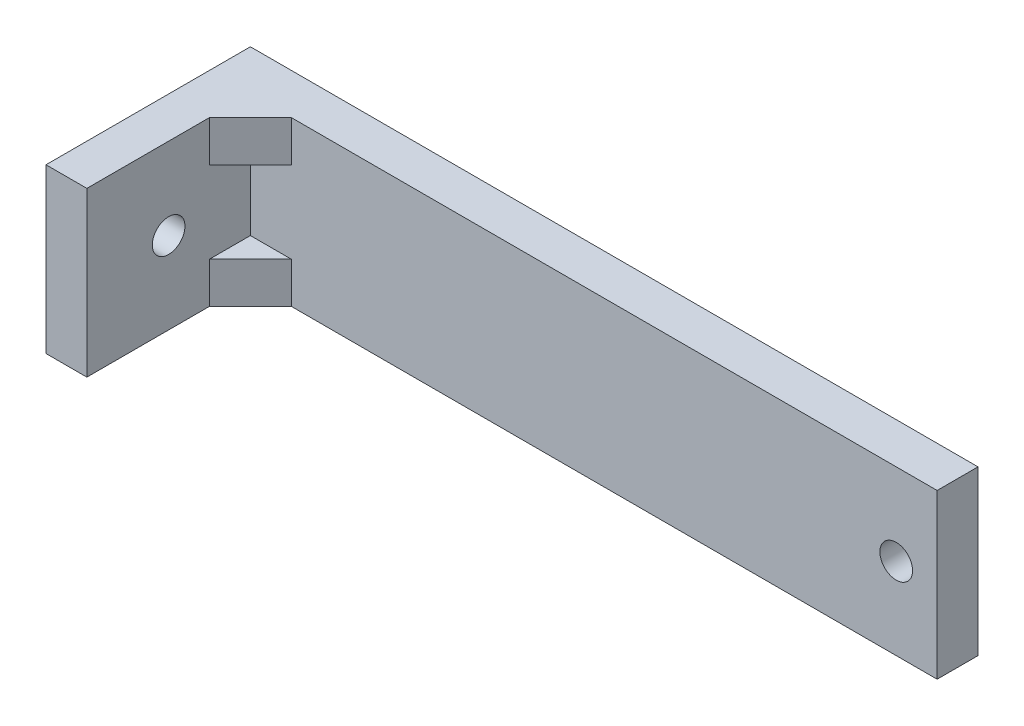
from build123d import *

# Parameters (mm, degrees)
SKETCH1_W           = 89
SKETCH1_H           = 20
BOSS_EXTRUDE1_DEPTH = 5
SKETCH2_W           = 5
SKETCH2_H           = 20
BOSS_EXTRUDE2_DEPTH = 20
SKETCH3_R           = 2
CUT_EXTRUDE1_DEPTH  = 89.20997676
SKETCH4_R           = 2
CUT_EXTRUDE2_DEPTH  = 20
SKETCH5_W           = 5
SKETCH5_H           = 5
BOSS_EXTRUDE3_DEPTH = 5
CUT_EXTRUDE3_DEPTH  = 55.820160525


with BuildPart() as part:
    # Sketch1 → Boss-Extrude1 (new body)
    with BuildSketch(Plane.XY):
        Rectangle(SKETCH1_W, SKETCH1_H)
    extrude(amount=BOSS_EXTRUDE1_DEPTH)

    # Sketch2 → Boss-Extrude2 (add)
    with BuildSketch(Plane.XY.offset(5)):
        with Locations((-42, 0)):
            Rectangle(SKETCH2_W, SKETCH2_H)
    extrude(amount=BOSS_EXTRUDE2_DEPTH)

    # Sketch3 → Cut-Extrude1 (cut, through all)
    with BuildSketch(Plane(origin=(-39.5, 0, 0), x_dir=(0, 0, -1), z_dir=(1, 0, 0))):
        with Locations((-15, 0)):
            Circle(SKETCH3_R)
    extrude(amount=-CUT_EXTRUDE1_DEPTH, mode=Mode.SUBTRACT)

    # Sketch4 → Cut-Extrude2 (cut)
    with BuildSketch(Plane(origin=(0, 0, 0), x_dir=(-1, 0, 0), z_dir=(0, 0, -1))):
        with Locations((-39.5, 0)):
            Circle(SKETCH4_R)
    extrude(amount=-CUT_EXTRUDE2_DEPTH, mode=Mode.SUBTRACT)

    # Sketch5 → Boss-Extrude3 (add)
    with BuildSketch(Plane(origin=(-39.5, 0, 0), x_dir=(0, 0, -1), z_dir=(1, 0, 0))):
        with Locations((-7.5, -7.5)):
            Rectangle(SKETCH5_W, SKETCH5_H)
        with Locations((-7.5, 7.5)):
            Rectangle(SKETCH5_W, SKETCH5_H)
    extrude(amount=BOSS_EXTRUDE3_DEPTH)

    # Sketch6 → Cut-Extrude3 (cut, through all)
    with BuildSketch(Plane(origin=(0, 10, 0), x_dir=(1, 0, 0), z_dir=(0, 1, 0))):
        Polygon((-34.5, -5), (-39.5, -10), (-34.5, -10), align=None)
    extrude(amount=-CUT_EXTRUDE3_DEPTH, mode=Mode.SUBTRACT)


solid = part.part
